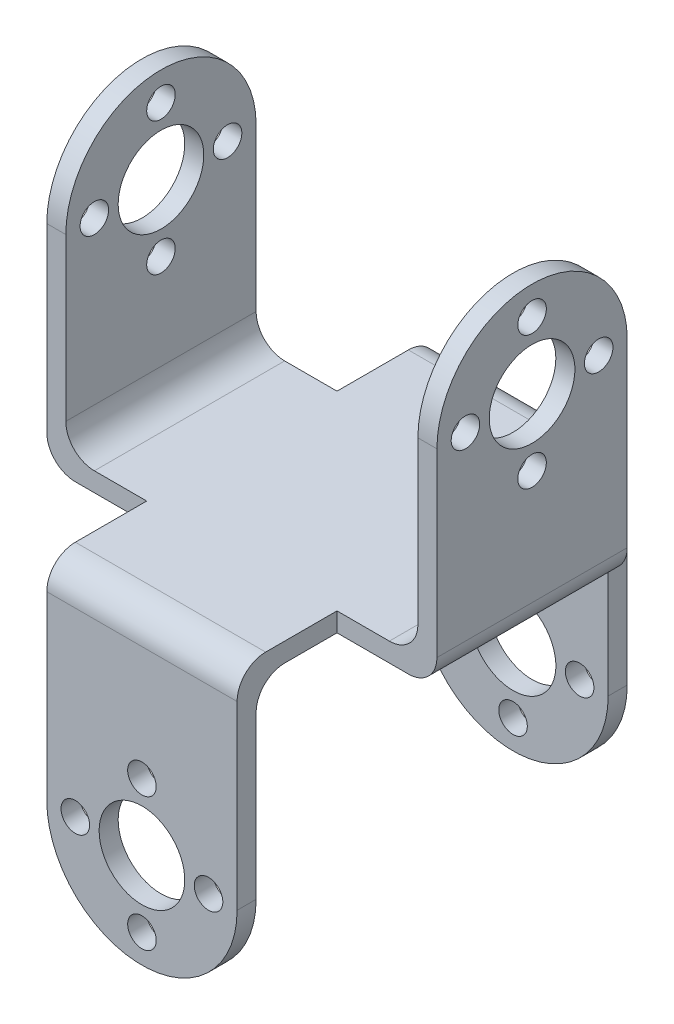
from build123d import *

# Parameters (mm, degrees)
EXTRUDE_1_DEPTH     = 2
SKETCH_2_W          = 2
SKETCH_2_H          = 20
EXTRUDE_2_DEPTH     = 40
FILLET_1_R          = 3
SKETCH_4_W          = 20
SKETCH_4_H          = 2
EXTRUDE_3_DEPTH     = 40
FILLET_2_R          = 3
SKETCH_5_R          = 4.5
SKETCH_5_R_2        = 1.5
CUT_EXTRUDE_1_DEPTH = 63.171134781
SKETCH_6_R          = 4.5
SKETCH_6_R_2        = 1.5
CUT_EXTRUDE_2_DEPTH = 63.171134781


with BuildPart() as part:
    # 草图1 → 凸台-拉伸1 (new body)
    with BuildSketch(Plane(origin=(0, 0, 0), x_dir=(1, 0, 0), z_dir=(0, 1, 0))):
        Polygon((10, -10), (10, -20.5), (-10, -20.5), (-10, -10), (-20.5, -10), (-20.5, 10), (-10, 10), (-10, 20.5), (10, 20.5), (10, 10), (20.5, 10), (20.5, -10), align=None)
    extrude(amount=EXTRUDE_1_DEPTH)

    # 草图2 → 凸台-拉伸2 (add)
    with BuildSketch(Plane(origin=(0, 2, 0), x_dir=(1, 0, 0), z_dir=(0, 1, 0))):
        with Locations((-19.5, 0)):
            Rectangle(SKETCH_2_W, SKETCH_2_H)
        with Locations((19.5, 0)):
            Rectangle(SKETCH_2_W, SKETCH_2_H)
    extrude(amount=EXTRUDE_2_DEPTH)

    # 圆角1
    fillet_1_edges = [part.edges().sort_by_distance(p)[0] for p in [
        (-20.5, 0, 0),
        (20.5, 0, 0),
        (-18.5, 2, 0),
        (18.5, 2, 0),
    ]]
    fillet(fillet_1_edges, radius=FILLET_1_R)

    # 草图4 → 凸台-拉伸3 (add)
    with BuildSketch(Plane.XZ):
        with Locations((0, 19.5)):
            Rectangle(SKETCH_4_W, SKETCH_4_H)
        with Locations((0, -19.5)):
            Rectangle(SKETCH_4_W, SKETCH_4_H)
    extrude(amount=EXTRUDE_3_DEPTH)

    # 圆角2
    fillet_2_edges = [part.edges().sort_by_distance(p)[0] for p in [
        (0, 2, -20.5),
        (0, 2, 20.5),
        (0, 0, 18.5),
        (0, 0, -18.5),
    ]]
    fillet(fillet_2_edges, radius=FILLET_2_R)

    # 草图5 → 切除-拉伸1 (cut, through all)
    with BuildSketch(Plane(origin=(0, 0, -20.5), x_dir=(-1, 0, 0), z_dir=(0, 0, -1))):
        with Locations((0, -20)):
            Circle(SKETCH_5_R)
        with Locations((0, -13)):
            Circle(SKETCH_5_R_2)
        with Locations((7, -20)):
            Circle(SKETCH_5_R_2)
        with Locations((0, -27)):
            Circle(SKETCH_5_R_2)
        with Locations((-7, -20)):
            Circle(SKETCH_5_R_2)
        with BuildLine():
            Line((-10, -20), (-10, -40))
            Line((-10, -40), (10, -40))
            Line((10, -40), (10, -20))
            ThreePointArc((10, -20), (0, -30), (-10, -20))
        make_face()
    extrude(amount=-CUT_EXTRUDE_1_DEPTH, mode=Mode.SUBTRACT)

    # 草图6 → 切除-拉伸2 (cut, through all)
    with BuildSketch(Plane.ZY.offset(20.5)):
        with Locations((0, 22)):
            Circle(SKETCH_6_R)
        with Locations((0, 15)):
            Circle(SKETCH_6_R_2)
        with Locations((-7, 22)):
            Circle(SKETCH_6_R_2)
        with Locations((0, 29)):
            Circle(SKETCH_6_R_2)
        with Locations((7, 22)):
            Circle(SKETCH_6_R_2)
        with BuildLine():
            Line((-10, 22), (-10, 42))
            Line((-10, 42), (10, 42))
            Line((10, 42), (10, 22))
            ThreePointArc((10, 22), (0, 32), (-10, 22))
        make_face()
    extrude(amount=-CUT_EXTRUDE_2_DEPTH, mode=Mode.SUBTRACT)


solid = part.part
